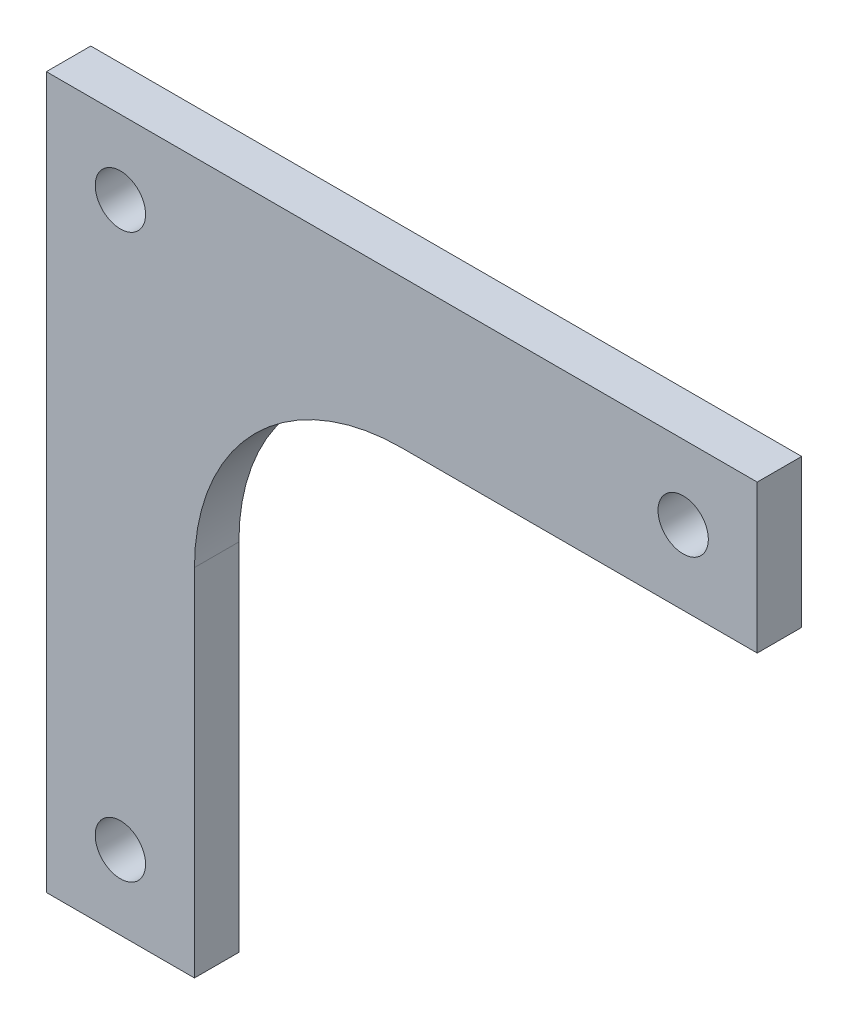
from build123d import *

# Parameters (mm, degrees)
SKETCH_1_R      = 1.7
EXTRUDE_1_DEPTH = 3


with BuildPart() as part:
    # 草图1 → 凸台-拉伸1 (new body)
    with BuildSketch(Plane.XY):
        with BuildLine():
            Line((0, 0), (0, 24))
            Line((0, 24), (24, 24))
            Line((24, 24), (38, 24))
            Line((38, 24), (48, 24))
            Line((48, 24), (48, 14))
            Line((48, 14), (34, 14))
            Line((34, 14), (24, 14))
            ThreePointArc((24, 14), (14.100505063, 9.899494937), (10, 0))
            Line((10, 0), (10, -12))
            Line((10, -12), (10, -24))
            Line((10, -24), (0, -24))
            Line((0, -24), (0, -14))
            Line((0, -14), (0, 0))
        make_face()
        with Locations((43, 19)):
            Circle(SKETCH_1_R, mode=Mode.SUBTRACT)
        with Locations((5, -19)):
            Circle(SKETCH_1_R, mode=Mode.SUBTRACT)
        with Locations((5, 19)):
            Circle(SKETCH_1_R, mode=Mode.SUBTRACT)
    extrude(amount=EXTRUDE_1_DEPTH)


solid = part.part
